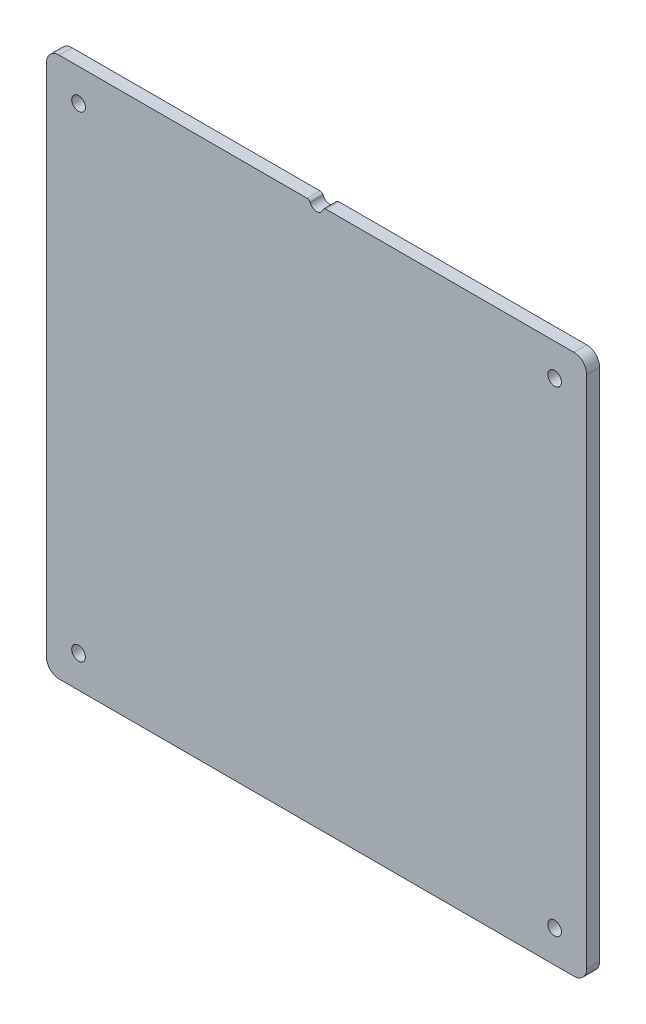
from build123d import *

# Parameters (mm, degrees)
SKETCH1_W               = 266.7
SKETCH1_H               = 266.7
BOSS_EXTRUDE1_DEPTH     = 6.35
F_1_4_CLEARANCE_HOLE1_D = 6.7564
FILLET1_R               = 6.35
SKETCH4_R               = 3.302
CUT_EXTRUDE1_DEPTH      = 189.692256068
FILLET2_R               = 1.5875


with BuildPart() as part:
    # Sketch1 → Boss-Extrude1 (new body)
    with BuildSketch(Plane.XY):
        Rectangle(SKETCH1_W, SKETCH1_H)
    extrude(amount=BOSS_EXTRUDE1_DEPTH)

    # 1/4 Clearance Hole1 (through all)
    with Locations(Plane.XY.offset(6.35)):
        with Locations((-117.475, 117.475), (-117.475, -117.475), (117.475, -117.475), (117.475, 117.475)):
            Hole(F_1_4_CLEARANCE_HOLE1_D / 2)

    # Fillet1
    fillet1_edges = [part.edges().sort_by_distance(p)[0] for p in [
        (133.35, -133.35, 3.175),
        (-133.35, -133.35, 3.175),
        (-133.35, 133.35, 3.175),
        (133.35, 133.35, 3.175),
    ]]
    fillet(fillet1_edges, radius=FILLET1_R)

    # Sketch4 → Cut-Extrude1 (cut, through all)
    with BuildSketch(Plane.XY.offset(6.35)):
        with Locations((0, 133.35)):
            Circle(SKETCH4_R)
    extrude(amount=-CUT_EXTRUDE1_DEPTH, mode=Mode.SUBTRACT)

    # Fillet2
    fillet2_edges = [part.edges().sort_by_distance(p)[0] for p in [
        (-3.302, 133.35, 3.175),
        (3.302, 133.35, 3.175),
    ]]
    fillet(fillet2_edges, radius=FILLET2_R)


solid = part.part
